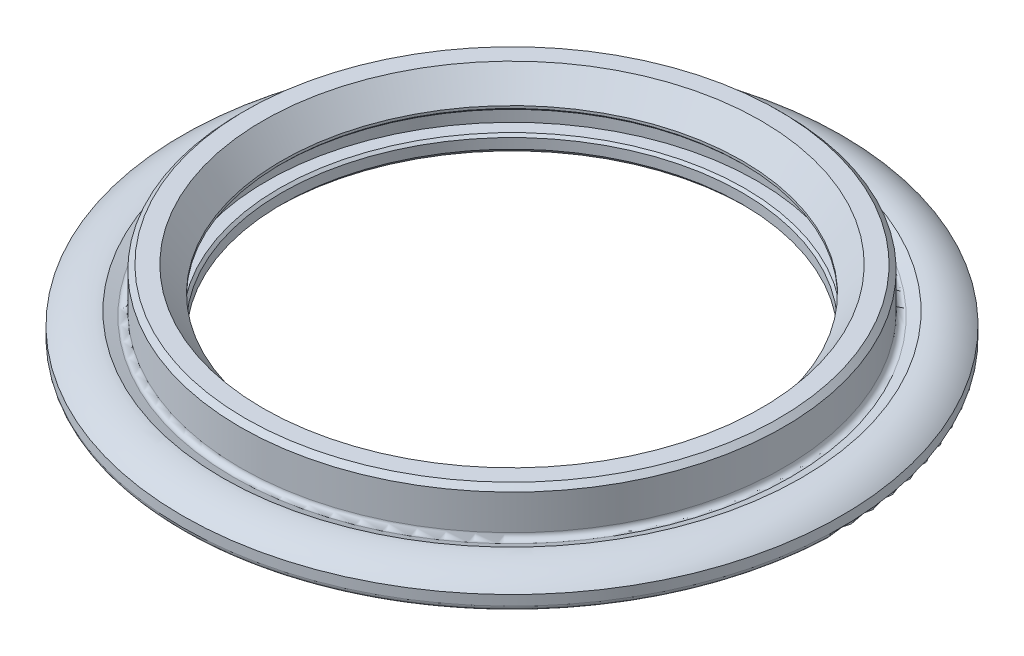
from build123d import *

# Parameters (mm, degrees)
FILETE1_R     = 2
FILETE2_R     = 1
FILETE3_R     = 1
CHANFRO1_SIZE = 1
CHANFRO2_SIZE = 0.5
CHANFRO3_SIZE = 1
FILETE4_R     = 1


with BuildPart() as part:
    # Esboço1 → Revolução1 (revolve)
    with BuildSketch(Plane.XY, mode=Mode.PRIVATE) as revolu_o1_sk:
        with BuildLine():
            Line((58, 0), (61, 2))
            Line((61, 2), (63.666666667, 0))
            Line((63.666666667, 0), (65.5, 0))
            Line((65.5, 0), (65.5, 3))
            ThreePointArc((65.5, 3), (61.774559179, 5.128589372), (57.5, 5.5))
            Line((57.5, 5.5), (54, 4))
            Line((54, 4), (54, 13.5))
            Line((54, 13.5), (49.5, 13.5))
            Line((49.5, 13.5), (45.75, 8.5))
            Line((45.75, 8.5), (45.75, 7.5))
            Line((45.75, 7.5), (48.75, 7.5))
            Line((48.75, 7.5), (48.75, 3.5))
            Line((48.75, 3.5), (45.75, 3.5))
            Line((45.75, 3.5), (45.75, 0))
            Line((45.75, 0), (58, 0))
        make_face()
    revolve(revolu_o1_sk.sketch.rotate(Axis((0, -63.329102972, 0), (0, 1, 0)), 90), axis=Axis((0, -63.329102972, 0), (0, 1, 0)))

    # Filete1
    filete1_edges = [part.edges().sort_by_distance(p)[0] for p in [
        (0, 2, 61),
    ]]
    fillet(filete1_edges, radius=FILETE1_R)

    # Filete2
    filete2_edges = [part.edges().sort_by_distance(p)[0] for p in [
        (0, 0, 63.666666667),
    ]]
    fillet(filete2_edges, radius=FILETE2_R)

    # Filete3
    filete3_edges = [part.edges().sort_by_distance(p)[0] for p in [
        (0, 0, 65.5),
    ]]
    fillet(filete3_edges, radius=FILETE3_R)

    # Chanfro1
    chanfro1_edges = [part.edges().sort_by_distance(p)[0] for p in [
        (0, 0, 45.75),
    ]]
    chamfer(chanfro1_edges, length=CHANFRO1_SIZE)

    # Chanfro2
    chanfro2_edges = [part.edges().sort_by_distance(p)[0] for p in [
        (0, 7.5, 45.75),
        (0, 3.5, 45.75),
    ]]
    chamfer(chanfro2_edges, length=CHANFRO2_SIZE)

    # Chanfro3
    chanfro3_edges = [part.edges().sort_by_distance(p)[0] for p in [
        (0, 13.5, 54),
    ]]
    chamfer(chanfro3_edges, length=CHANFRO3_SIZE)

    # Filete4
    filete4_edges = [part.edges().sort_by_distance(p)[0] for p in [
        (0, 4, 54),
    ]]
    fillet(filete4_edges, radius=FILETE4_R)


solid = part.part
